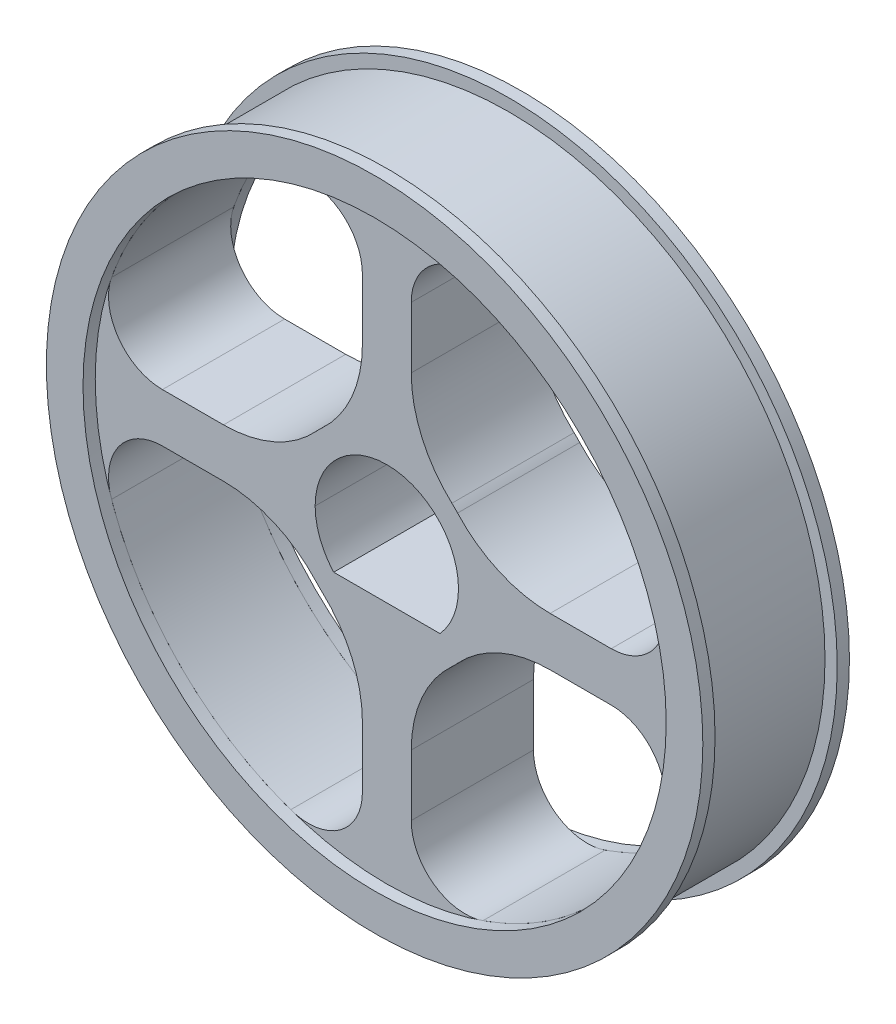
from build123d import *

# Parameters (mm, degrees)
SKETCH1_R           = 6.569999999
SKETCH1_R_2         = 6.061999999
SKETCH1_R_3         = 1.997999999
BOSS_EXTRUDE1_DEPTH = 1.27
BOSS_EXTRUDE2_START = 1.27
SKETCH1_5_R         = 6.823999999
SKETCH1_5_R_2       = 6.061999999
BOSS_EXTRUDE2_DEPTH = 0.254


with BuildPart() as part:
    # Sketch1 → Boss-Extrude1 (new, symmetric)
    # profile 1 of 6: a face of its own
    with BuildSketch(Plane.XY):
        with Locations((-14.585173992, 6.361392546)):
            Circle(SKETCH1_R)
        with Locations((-14.585173992, 6.361392546)):
            Circle(SKETCH1_R_2, mode=Mode.SUBTRACT)
    # profile 2 of 6: a face of its own
    with BuildSketch(Plane.XY):
        with BuildLine():
            Line((-14.077173992, 9.756392545), (-14.077173992, 11.026392545))
            ThreePointArc((-14.077173992, 11.026392545), (-13.605249635, 11.940269174), (-12.586887207, 12.084564212))
            ThreePointArc((-12.586887207, 12.084564212), (-14.585173992, 12.423392545), (-16.583460777, 12.084564212))
            ThreePointArc((-16.583460777, 12.084564212), (-15.565098349, 11.940269174), (-15.093173992, 11.026392545))
            Line((-15.093173992, 11.026392545), (-15.093173992, 9.756392545))
            ThreePointArc((-15.093173992, 9.756392545), (-15.313620832, 8.705559935), (-15.937790686, 7.831913568))
            ThreePointArc((-15.937790686, 7.831913568), (-14.585173992, 8.359392545), (-13.232557298, 7.831913568))
            ThreePointArc((-13.232557298, 7.831913568), (-13.856727152, 8.705559935), (-14.077173992, 9.756392545))
        make_face()
    # profile 3 of 6: a face of its own
    with BuildSketch(Plane.XY):
        with BuildLine():
            ThreePointArc((-8.523173993, 6.361392546), (-8.608481319, 7.374797044), (-8.862002326, 8.35967933))
            ThreePointArc((-8.862002326, 8.35967933), (-9.006297363, 7.341316902), (-9.920173993, 6.869392546))
            Line((-9.920173993, 6.869392546), (-11.190173993, 6.869392546))
            ThreePointArc((-11.190173993, 6.869392546), (-12.241006602, 7.089839385), (-13.11465297, 7.714009239))
            ThreePointArc((-13.11465297, 7.714009239), (-12.723708843, 7.087306795), (-12.587173993, 6.361392546))
            ThreePointArc((-12.587173993, 6.361392546), (-12.723708843, 5.635478296), (-13.11465297, 5.008775852))
            ThreePointArc((-13.11465297, 5.008775852), (-12.241006602, 5.632945706), (-11.190173993, 5.853392546))
            Line((-11.190173993, 5.853392546), (-9.920173993, 5.853392546))
            ThreePointArc((-9.920173993, 5.853392546), (-9.006297363, 5.381468189), (-8.862002326, 4.363105761))
            ThreePointArc((-8.862002326, 4.363105761), (-8.608481319, 5.347988047), (-8.523173993, 6.361392546))
        make_face()
    # profile 4 of 6: a face of its own
    with BuildSketch(Plane.XY):
        with BuildLine():
            ThreePointArc((-19.250173991, 6.869392546), (-20.164050621, 7.341316902), (-20.308345658, 8.35967933))
            ThreePointArc((-20.308345658, 8.35967933), (-20.647173991, 6.361392546), (-20.308345658, 4.363105761))
            ThreePointArc((-20.308345658, 4.363105761), (-20.164050621, 5.381468189), (-19.250173991, 5.853392546))
            Line((-19.250173991, 5.853392546), (-17.980173991, 5.853392546))
            ThreePointArc((-17.980173991, 5.853392546), (-16.929341382, 5.632945706), (-16.055695014, 5.008775852))
            ThreePointArc((-16.055695014, 5.008775852), (-16.583173991, 6.361392546), (-16.055695014, 7.714009239))
            ThreePointArc((-16.055695014, 7.714009239), (-16.929341382, 7.089839385), (-17.980173991, 6.869392546))
            Line((-17.980173991, 6.869392546), (-19.250173991, 6.869392546))
        make_face()
    # profile 5 of 6: a face of its own
    with BuildSketch(Plane.XY):
        with BuildLine():
            ThreePointArc((-16.583460777, 0.63822088), (-14.585173992, 0.299392546), (-12.586887207, 0.63822088))
            ThreePointArc((-12.586887207, 0.63822088), (-13.605249635, 0.782515917), (-14.077173992, 1.696392546))
            Line((-14.077173992, 1.696392546), (-14.077173992, 2.966392546))
            ThreePointArc((-14.077173992, 2.966392546), (-13.856727152, 4.017225156), (-13.232557298, 4.890871523))
            ThreePointArc((-13.232557298, 4.890871523), (-14.585173992, 4.363392546), (-15.937790686, 4.890871523))
            ThreePointArc((-15.937790686, 4.890871523), (-15.313620832, 4.017225156), (-15.093173992, 2.966392546))
            Line((-15.093173992, 2.966392546), (-15.093173992, 1.696392546))
            ThreePointArc((-15.093173992, 1.696392546), (-15.565098349, 0.782515917), (-16.583460777, 0.63822088))
        make_face()
    # profile 6 of 6: a face of its own
    with BuildSketch(Plane.XY):
        with Locations((-14.585173992, 6.361392546)):
            Circle(SKETCH1_R_3)
        with BuildLine():
            add(Edge.make_bspline(
                [(-13.480592623, 5.361392545), (-13.460539436, 5.384341171), (-13.420470859, 5.430195167), (-13.365842841, 5.503511201), (-13.307154336, 5.59247995), (-13.248045319, 5.69918428), (-13.192924177, 5.824787769), (-13.14943929, 5.954910636), (-13.118404819, 6.088487495), (-13.098791679, 6.224357356), (-13.096379888, 6.315714149), (-13.095173993, 6.361392546)],
                knots=[0, 0, 0, 0, 0.083397986, 0.166638776, 0.250036761, 0.375030634, 0.500024507, 0.62501838, 0.750012254, 0.875006127, 1, 1, 1, 1], degree=3))
            ThreePointArc((-13.095173993, 6.361392546), (-14.585173992, 7.851392545), (-16.075173991, 6.361392546))
            add(Edge.make_bspline(
                [(-16.075173991, 6.361392546), (-16.074638254, 6.330921531), (-16.073567789, 6.270036937), (-16.064859774, 6.179022479), (-16.04865674, 6.073679037), (-16.020862372, 5.954905457), (-15.977427672, 5.824797796), (-15.922333529, 5.699149352), (-15.85569141, 5.579296345), (-15.779043389, 5.46540879), (-15.719518037, 5.396064627), (-15.689755361, 5.361392545)],
                knots=[0, 0, 0, 0, 0.083397986, 0.166638774, 0.25003676, 0.375030634, 0.500024507, 0.62501838, 0.750012253, 0.875006126, 1, 1, 1, 1], degree=3))
            Line((-15.689755361, 5.361392545), (-13.480592623, 5.361392545))
        make_face(mode=Mode.SUBTRACT)
    extrude(amount=BOSS_EXTRUDE1_DEPTH, both=True)


with BuildPart() as body_2:
    # Sketch1<5> → Boss-Extrude2 (new body)
    with BuildSketch(Plane.XY.offset(BOSS_EXTRUDE2_START)):
        with Locations((-14.585173992, 6.361392546)):
            Circle(SKETCH1_5_R)
        with Locations((-14.585173992, 6.361392546)):
            Circle(SKETCH1_5_R_2, mode=Mode.SUBTRACT)
    extrude(amount=BOSS_EXTRUDE2_DEPTH)


with BuildPart() as body_3:
    # Mirror2: mirrored copy
    add(body_2.part.mirror(Plane.XY))


solid = Compound([part.part, body_2.part, body_3.part])
